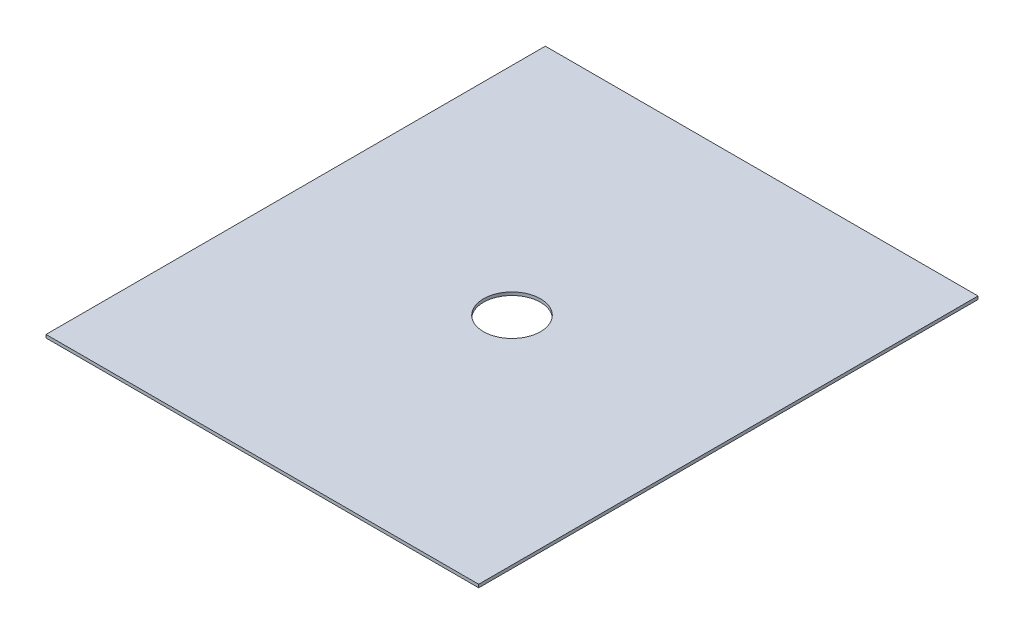
from build123d import *

# Parameters (mm, degrees)
SKETCH1_W          = 277.3
SKETCH1_H          = 320
TOP_DEPTH          = 2
SKETCH2_R          = 18.281466349
CUT_EXTRUDE1_DEPTH = 10


with BuildPart() as part:
    # Sketch1 → Top (new body)
    with BuildSketch(Plane(origin=(0, 0, 0), x_dir=(1, 0, 0), z_dir=(0, 1, 0))):
        Rectangle(SKETCH1_W, SKETCH1_H)
    extrude(amount=TOP_DEPTH)

    # Sketch2 → Cut-Extrude1 (cut)
    with BuildSketch(Plane(origin=(0, 2, 0), x_dir=(1, 0, 0), z_dir=(0, 1, 0))):
        with Locations(Location((0, 0, 0), (0, 0, 270))):
            Circle(SKETCH2_R)
    extrude(amount=-CUT_EXTRUDE1_DEPTH, mode=Mode.SUBTRACT)


solid = part.part
